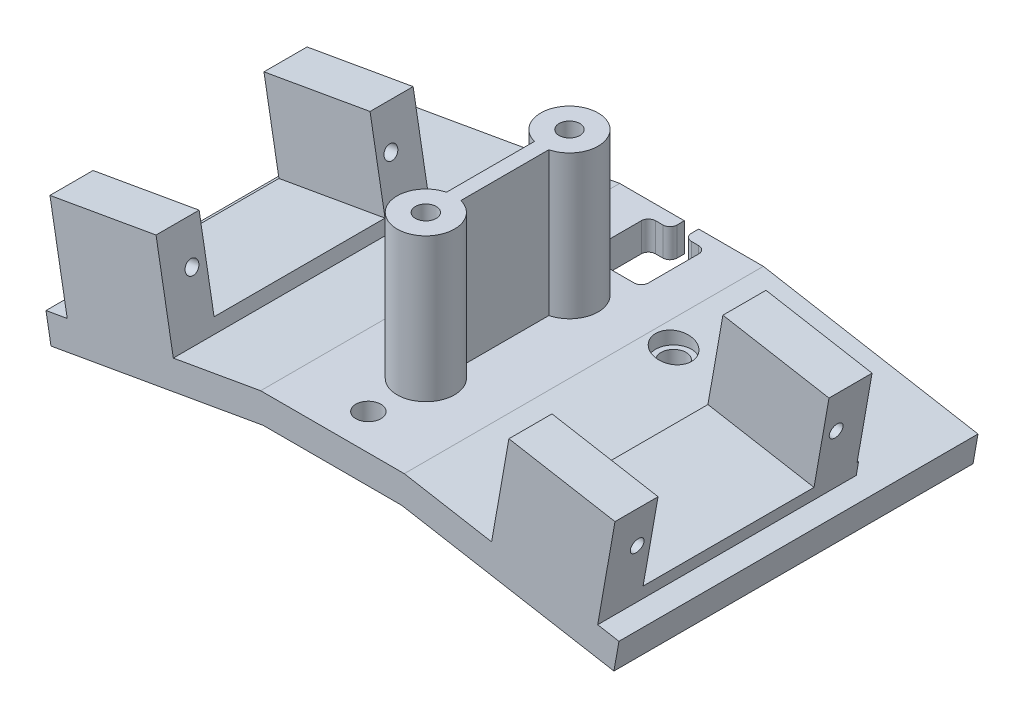
from build123d import *

# Parameters (mm, degrees)
EXTRUDE_1_DEPTH     = 25
EXTRUDE_2_DEPTH     = 36
SKETCH_3_W          = 15
SKETCH_3_H          = 6
EXTRUDE_3_DEPTH     = 12
SKETCH_4_R          = 0.95
CUT_EXTRUDE_1_DEPTH = 21
SKETCH_5_R          = 4
SKETCH_5_R_2        = 1.45
EXTRUDE_4_DEPTH     = 20
EXTRUDE_4_2_DEPTH   = 20
SKETCH_6_R          = 1.75
CUT_EXTRUDE_2_DEPTH = 20
SKETCH_7_R          = 2.5
CUT_EXTRUDE_3_DEPTH = 2
CUT_EXTRUDE_4_DEPTH = 52.148040055
FILLET_4_R          = 1
SKETCH_9_W          = 2
SKETCH_9_H          = 14
EXTRUDE_5_DEPTH     = 20


with BuildPart() as part:
    # 草图1 → 凸台-拉伸1 (new, symmetric)
    with BuildSketch(Plane.XY):
        Polygon((0, 0), (9.650045346, 0), (39.194277936, -5.20944533), (39.888870647, -1.270214318), (10, 4), (0, 4), align=None)
    extrude_1 = extrude(amount=EXTRUDE_1_DEPTH, both=True)

    # 草图2 → 凸台-拉伸2 (add)
    with BuildSketch(Plane.XY.offset(25)):
        Polygon((22.162331093, 1.85545288), (22.483580221, 3.677347223), (37.255696517, 1.072624558), (36.934447388, -0.749269785), align=None)
    extrude_2 = extrude(amount=-EXTRUDE_2_DEPTH)

    # 草图3 → 凸台-拉伸3 (add)
    with BuildSketch(Plane(origin=(1.306826311, 7.411380301, 0), x_dir=(0.9848077530122079, -0.1736481776669312, 0), z_dir=(0.1736481776669312, 0.9848077530122079, 0))):
        with Locations((29.003439474, -22)):
            Rectangle(SKETCH_3_W, SKETCH_3_H)
        with Locations((29.003439474, 7.8)):
            Rectangle(SKETCH_3_W, SKETCH_3_H)
    extrude_3 = extrude(amount=EXTRUDE_3_DEPTH)

    # 草图4 → 切除-拉伸1 (cut)
    with BuildSketch(Plane(origin=(35.948870205, -6.338755743, 0), x_dir=(0, 0, -1), z_dir=(0.9848077530122081, -0.17364817766693072, 0))):
        with Locations(Location((-20.95, 14.025712789, 0), (0, 0, 90))):
            Circle(SKETCH_4_R)
        with Locations(Location((6.75, 14.025712789, 0), (0, 0, 90))):
            Circle(SKETCH_4_R)
    cut_extrude_1 = extrude(amount=-CUT_EXTRUDE_1_DEPTH, mode=Mode.SUBTRACT)

    # 镜向1: 凸台-拉伸1, 凸台-拉伸2, 凸台-拉伸3, 切除-拉伸1 across plane
    add(extrude_1.mirror(Plane(origin=(0, 0, 0), x_dir=(0, 0, 1), z_dir=(1, 0, 0))))
    add(extrude_2.mirror(Plane(origin=(0, 0, 0), x_dir=(0, 0, 1), z_dir=(1, 0, 0))))
    add(extrude_3.mirror(Plane(origin=(0, 0, 0), x_dir=(0, 0, 1), z_dir=(1, 0, 0))))
    add(cut_extrude_1.mirror(Plane(origin=(0, 0, 0), x_dir=(0, 0, 1), z_dir=(1, 0, 0))), mode=Mode.SUBTRACT)

    # 草图6 → 切除-拉伸2 (cut)
    with BuildSketch(Plane(origin=(0, 4, 0), x_dir=(1, 0, 0), z_dir=(0, 1, 0))):
        with Locations(Location((0, -20, 0), (0, 0, 180))):
            Circle(SKETCH_6_R)
        with Locations((-13, 9.5)):
            Circle(SKETCH_6_R)
        with Locations(Location((13, 9.5, 0), (0, 0, 180))):
            Circle(SKETCH_6_R)
    extrude(amount=-CUT_EXTRUDE_2_DEPTH, mode=Mode.SUBTRACT)

    # 草图7 → 切除-拉伸3 (cut)
    with BuildSketch(Plane(origin=(0, 4, 0), x_dir=(1, 0, 0), z_dir=(0, 1, 0))):
        with Locations(Location((-13, 9.5, 0), (0, 0, 180))):
            Circle(SKETCH_7_R)
        with Locations(Location((13, 9.5, 0), (0, 0, 180))):
            Circle(SKETCH_7_R)
    extrude(amount=-CUT_EXTRUDE_3_DEPTH, mode=Mode.SUBTRACT)

    # 草图8 → 切除-拉伸4 (cut, through all)
    with BuildSketch(Plane(origin=(0, 4, 0), x_dir=(1, 0, 0), z_dir=(0, 1, 0))):
        Polygon((-4, 23), (-1, 23), (-1, 25), (1, 25), (1, 23), (4, 23), (4, 14), (-4, 14), align=None)
    extrude(amount=-CUT_EXTRUDE_4_DEPTH, mode=Mode.SUBTRACT)

    # 圆角4
    fillet_4_edges = [part.edges().sort_by_distance(p)[0] for p in [
        (4, 2, -23),
        (4, 2, -14),
        (-4, 2, -14),
        (-4, 2, -23),
        (1, 2, -23),
        (-1, 2, -23),
    ]]
    fillet(fillet_4_edges, radius=FILLET_4_R)



with BuildPart() as body_2:
    # 草图5 → 凸台-拉伸4 (new body)
    with BuildSketch(Plane(origin=(0, 4, 0), x_dir=(1, 0, 0), z_dir=(0, 1, 0))):
        with Locations(Location((0, -12, 0), (0, 0, 180))):
            Circle(SKETCH_5_R)
        with Locations(Location((0, -12, 0), (0, 0, 180))):
            Circle(SKETCH_5_R_2, mode=Mode.SUBTRACT)
    extrude(amount=EXTRUDE_4_DEPTH)


with BuildPart() as body_3:
    # 草图5 → Extrude 4 2 (new body)
    with BuildSketch(Plane(origin=(0, 4, 0), x_dir=(1, 0, 0), z_dir=(0, 1, 0))):
        with Locations(Location((0, 8, 0), (0, 0, 180))):
            Circle(SKETCH_5_R)
        with Locations(Location((0, 8, 0), (0, 0, 180))):
            Circle(SKETCH_5_R_2, mode=Mode.SUBTRACT)
    extrude(amount=EXTRUDE_4_2_DEPTH)


with BuildPart() as part_1:
    add(part.part)

    add(body_2.part)  # 凸台-拉伸5 merges body 2

    add(body_3.part)  # 凸台-拉伸5 merges body 3
    # 草图9 → 凸台-拉伸5 (add)
    with BuildSketch(Plane(origin=(0, 4, 0), x_dir=(1, 0, 0), z_dir=(0, 1, 0))):
        with Locations((0, -2)):
            Rectangle(SKETCH_9_W, SKETCH_9_H)
    extrude(amount=EXTRUDE_5_DEPTH)


solid = part_1.part
